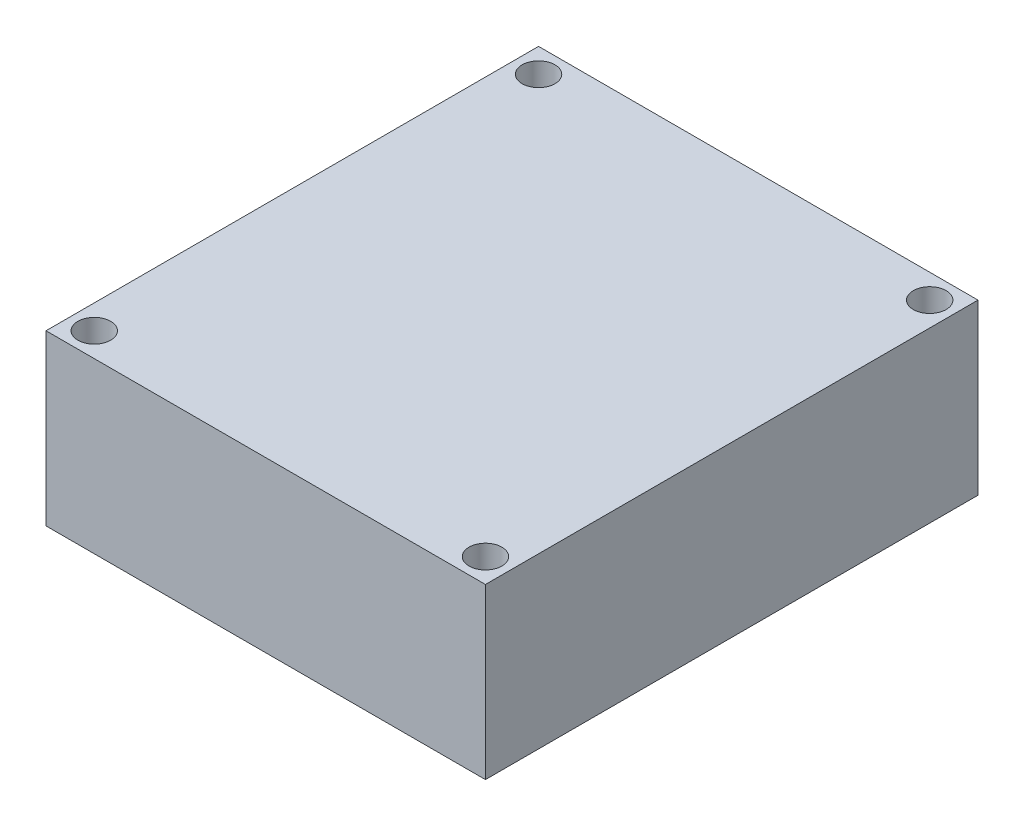
from build123d import *

# Parameters (mm, degrees)
SKETCH_1_W          = 45.5
SKETCH_1_H          = 51
EXTRUDE_1_DEPTH     = 17.5
SKETCH_2_R          = 1.7
CUT_EXTRUDE_1_DEPTH = 39.393521589


with BuildPart() as part:
    # 草图1 → 凸台-拉伸1 (new body)
    with BuildSketch(Plane(origin=(0, 0, 0), x_dir=(1, 0, 0), z_dir=(0, 1, 0))):
        Rectangle(SKETCH_1_W, SKETCH_1_H)
    extrude(amount=EXTRUDE_1_DEPTH)

    # 草图2 → 切除-拉伸1 (cut, through all)
    with BuildSketch(Plane(origin=(0, 17.5, 0), x_dir=(1, 0, 0), z_dir=(0, 1, 0))):
        with Locations(Location((20.25, -23, 0), (0, 0, 270))):
            Circle(SKETCH_2_R)
        with Locations(Location((-20.25, -23, 0), (0, 0, 90))):
            Circle(SKETCH_2_R)
        with Locations(Location((20.25, 23, 0), (0, 0, 90))):
            Circle(SKETCH_2_R)
        with Locations(Location((-20.25, 23, 0), (0, 0, 270))):
            Circle(SKETCH_2_R)
    extrude(amount=-CUT_EXTRUDE_1_DEPTH, mode=Mode.SUBTRACT)


solid = part.part
